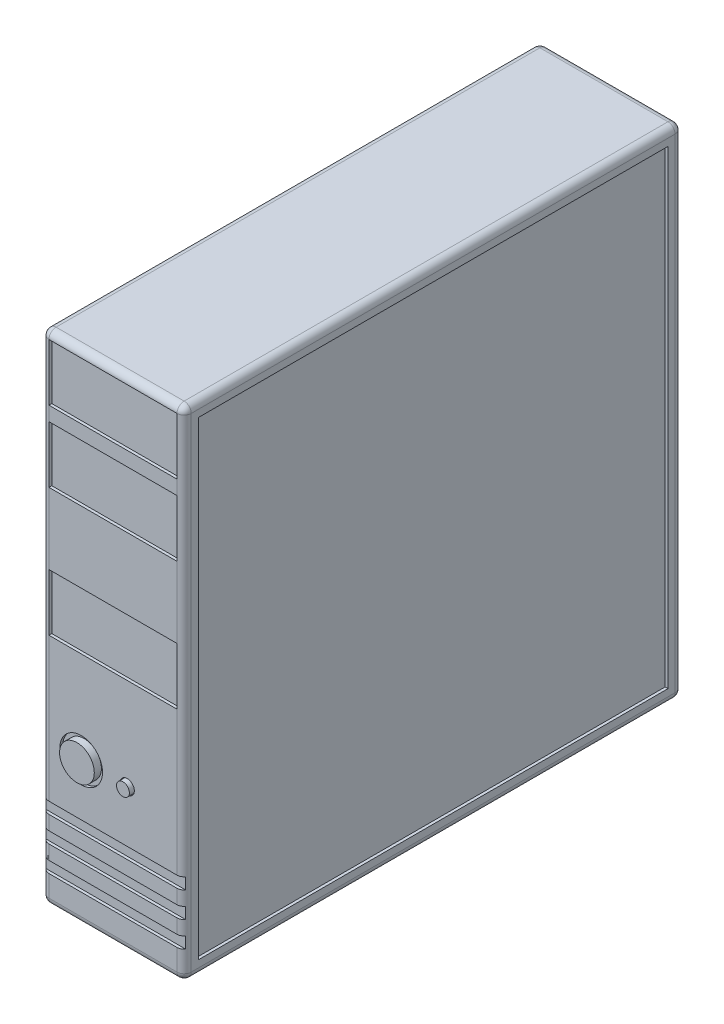
from build123d import *

# Parameters (mm, degrees)
CROQUIS1_W              = 100
CROQUIS1_H              = 350
SALIENTE_EXTRUIR1_DEPTH = 350
REDONDEO1_R             = 5
CROQUIS2_R              = 15
CROQUIS2_R_2            = 5
CROQUIS2_W              = 90
CROQUIS2_H              = 40
CROQUIS2_W_2            = 105.514825976
CROQUIS2_H_2            = 8
CORTAR_EXTRUIR1_DEPTH   = 2
CROQUIS3_R              = 12.203694642
CROQUIS3_R_2            = 4.521298069
SALIENTE_EXTRUIR2_DEPTH = 5
CROQUIS4_W              = 330
CROQUIS4_H              = 330
CORTAR_EXTRUIR2_DEPTH   = 72
CROQUIS5_W              = 330
CROQUIS5_H              = 330
CORTAR_EXTRUIR3_DEPTH   = 2


with BuildPart() as part:
    # Croquis1 → Saliente-Extruir1 (new body)
    with BuildSketch(Plane.XY):
        Rectangle(CROQUIS1_W, CROQUIS1_H)
    extrude(amount=-SALIENTE_EXTRUIR1_DEPTH)

    # Redondeo1
    redondeo1_edges = [part.edges().sort_by_distance(p)[0] for p in [
        (50, 0, -350),
        (0, 175, -350),
        (-50, 0, -350),
        (0, 175, 0),
        (50, 0, 0),
        (0, -175, 0),
        (-50, 0, 0),
        (0, -175, -350),
        (-50, 175, -175),
        (50, 175, -175),
        (50, -175, -175),
        (-50, -175, -175),
    ]]
    fillet(redondeo1_edges, radius=REDONDEO1_R)

    # Croquis2 → Cortar-Extruir1 (cut)
    with BuildSketch(Plane.XY):
        with Locations((-22.3397902, -74.689944443)):
            Circle(CROQUIS2_R)
        with Locations((10.014906412, -74.689944443)):
            Circle(CROQUIS2_R_2)
        with Locations((0, 150)):
            Rectangle(CROQUIS2_W, CROQUIS2_H)
        with Locations((0, 100)):
            Rectangle(CROQUIS2_W, CROQUIS2_H)
        with Locations((0, 10)):
            Rectangle(CROQUIS2_W, CROQUIS2_H)
        with Locations((-0.46526055, -151)):
            Rectangle(CROQUIS2_W_2, CROQUIS2_H_2)
        with Locations((-0.46526055, -133)):
            Rectangle(CROQUIS2_W_2, CROQUIS2_H_2)
        with Locations((-0.46526055, -115)):
            Rectangle(CROQUIS2_W_2, CROQUIS2_H_2)
    extrude(amount=-CORTAR_EXTRUIR1_DEPTH, mode=Mode.SUBTRACT)

    # Croquis3 → Saliente-Extruir2 (add)
    with BuildSketch(Plane.XY.offset(-2)):
        with Locations((-22.3397902, -74.689944443)):
            Circle(CROQUIS3_R)
        with Locations((10.014906412, -74.689944443)):
            Circle(CROQUIS3_R_2)
    extrude(amount=SALIENTE_EXTRUIR2_DEPTH)

    # Croquis4 → Cortar-Extruir2 (cut)
    with BuildSketch(Plane.ZY.offset(50)):
        with Locations((-175, 0)):
            Rectangle(CROQUIS4_W, CROQUIS4_H)
    extrude(amount=-CORTAR_EXTRUIR2_DEPTH, mode=Mode.SUBTRACT)

    # Croquis5 → Cortar-Extruir3 (cut)
    with BuildSketch(Plane(origin=(50, 0, 0), x_dir=(0, 0, -1), z_dir=(1, 0, 0))):
        with Locations((175, 0)):
            Rectangle(CROQUIS5_W, CROQUIS5_H)
    extrude(amount=-CORTAR_EXTRUIR3_DEPTH, mode=Mode.SUBTRACT)


solid = part.part
